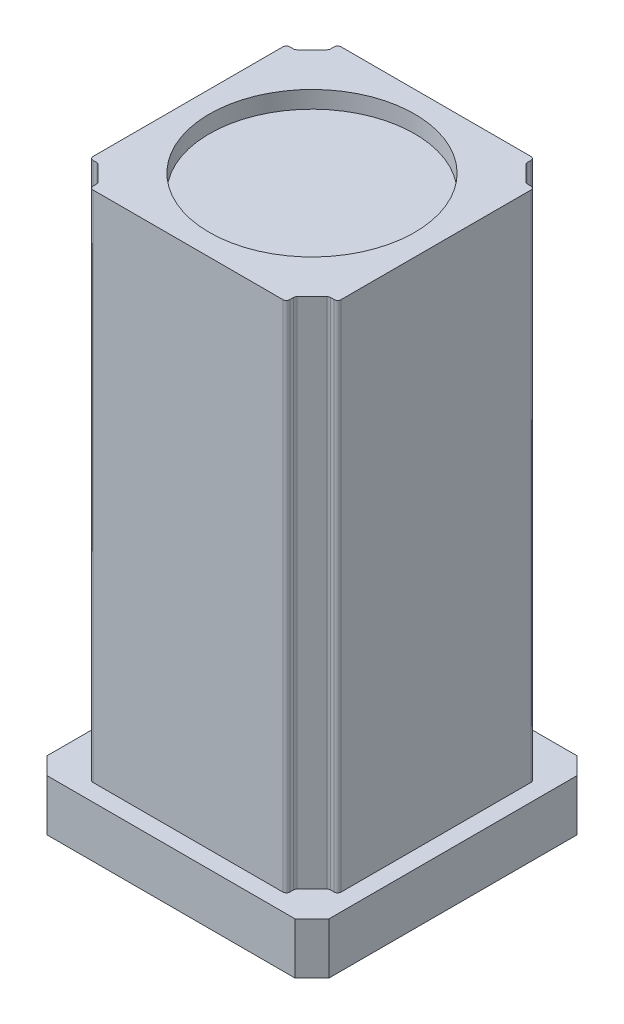
from build123d import *

# Parameters (mm, degrees)
BOSS_EXTRUDE1_DEPTH = 30
BOSS_EXTRUDE2_DEPTH = 300
SKETCH3_R           = 60
CUT_EXTRUDE1_DEPTH  = 10
FILLET1_R           = 2


with BuildPart() as part:
    # Sketch1 → Boss-Extrude1 (new body)
    with BuildSketch(Plane(origin=(0, 0, 0), x_dir=(1, 0, 0), z_dir=(0, 1, 0))):
        Polygon((-82.5, 72.5), (-72.5, 82.5), (72.5, 82.5), (82.5, 72.5), (82.5, -72.5), (72.5, -82.5), (-72.5, -82.5), (-82.5, -72.5), align=None)
    extrude(amount=BOSS_EXTRUDE1_DEPTH)

    # Sketch2 → Boss-Extrude2 (add)
    with BuildSketch(Plane(origin=(0, 30, 0), x_dir=(1, 0, 0), z_dir=(0, 1, 0))):
        Polygon((72.5, 57.5), (67.5, 57.5), (57.5, 67.5), (57.5, 72.5), (-57.5, 72.5), (-57.5, 67.5), (-67.5, 57.5), (-72.5, 57.5), (-72.5, -57.5), (-67.5, -57.5), (-57.5, -67.5), (-57.5, -72.5), (57.5, -72.5), (57.5, -67.5), (67.5, -57.5), (72.5, -57.5), align=None)
    extrude(amount=BOSS_EXTRUDE2_DEPTH)

    # Sketch3 → Cut-Extrude1 (cut)
    with BuildSketch(Plane(origin=(0, 330, 0), x_dir=(1, 0, 0), z_dir=(0, 1, 0))):
        with Locations(Location((0, 0, 0), (0, 0, 270))):
            Circle(SKETCH3_R)
    extrude(amount=-CUT_EXTRUDE1_DEPTH, mode=Mode.SUBTRACT)

    # Fillet1
    fillet1_edges = [part.edges().sort_by_distance(p)[0] for p in [
        (72.5, 180, 57.5),
        (72.5, 180, -57.5),
        (67.5, 180, -57.5),
        (57.5, 180, -67.5),
        (57.5, 180, -72.5),
        (-57.5, 180, -72.5),
        (-57.5, 180, -67.5),
        (-67.5, 180, -57.5),
        (-72.5, 180, -57.5),
        (-72.5, 180, 57.5),
        (-67.5, 180, 57.5),
        (-57.5, 180, 67.5),
        (-57.5, 180, 72.5),
        (57.5, 180, 72.5),
        (57.5, 180, 67.5),
        (67.5, 180, 57.5),
    ]]
    fillet(fillet1_edges, radius=FILLET1_R)


solid = part.part
